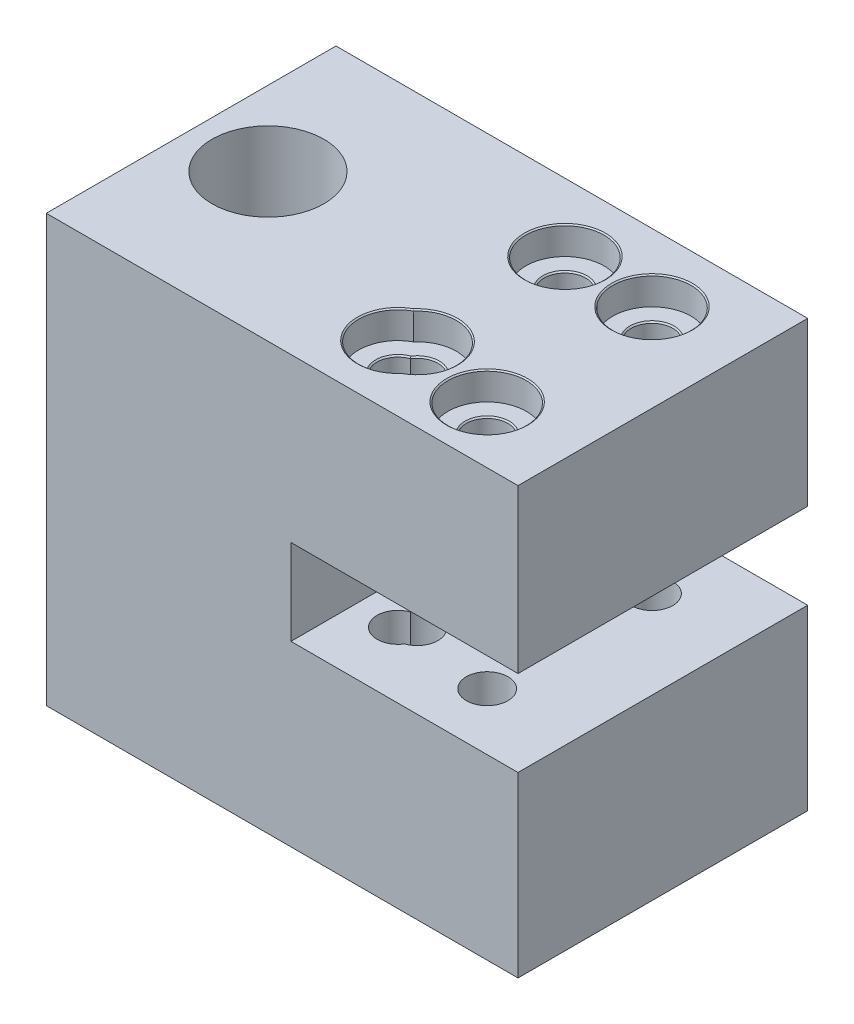
from build123d import *

# Parameters (mm, degrees)
SKETCH1_W                                      = 224.783024271
SKETCH1_H                                      = 138.046096427
BOSS_EXTRUDE1_DEPTH                            = 101.6
SKETCH2_R                                      = 26.66819347
CUT_EXTRUDE1_DEPTH                             = 108.204
SKETCH4_W                                      = 138.046096427
SKETCH4_H                                      = 40.817377809
CUT_EXTRUDE2_DEPTH                             = 108.204
CBORE_FOR_3_4_PAN_HEAD_MACHINE_SCREW1_AT_COUNT = 2
CBORE_FOR_3_4_PAN_HEAD_MACHINE_SCREW1_AT_PITCH = 78.529858642
CBORE_FOR_3_4_PAN_HEAD_MACHINE_SCREW_2_COUNT   = 2
CBORE_FOR_3_4_PAN_HEAD_MACHINE_SCREW_2_PITCH   = 88.813103961
CBORE_FOR_3_4_PAN_HEAD_MACHINE_SCREW_3_COUNT   = 2
CBORE_FOR_3_4_PAN_HEAD_MACHINE_SCREW_3_PITCH   = 46.772278414
CBORE_FOR_3_4_PAN_HEAD_MACHINE_SCREW_4_COUNT   = 2
CBORE_FOR_3_4_PAN_HEAD_MACHINE_SCREW_4_PITCH   = 42.272131605


with BuildPart() as part:
    # Sketch1 → Boss-Extrude1 (new, symmetric)
    with BuildSketch(Plane(origin=(0, 0, 0), x_dir=(1, 0, 0), z_dir=(0, 1, 0))):
        with Locations((-12.21646871, -1.018039059)):
            Rectangle(SKETCH1_W, SKETCH1_H)
    extrude(amount=BOSS_EXTRUDE1_DEPTH, both=True)

    # Sketch2 → Cut-Extrude1 (cut)
    with BuildSketch(Plane(origin=(0, 101.6, 0), x_dir=(1, 0, 0), z_dir=(0, 1, 0))):
        with Locations(Location((-89.023589675, 0, 0), (0, 0, 270))):
            Circle(SKETCH2_R)
    extrude(amount=-CUT_EXTRUDE1_DEPTH, mode=Mode.SUBTRACT)

    # Sketch4 → Cut-Extrude2 (cut)
    with BuildSketch(Plane(origin=(100.175043425, 0, 0), x_dir=(0, 0, -1), z_dir=(1, 0, 0))):
        with Locations((-1.018039059, 3.62821136)):
            Rectangle(SKETCH4_W, SKETCH4_H)
    extrude(amount=-CUT_EXTRUDE2_DEPTH, mode=Mode.SUBTRACT)

    # Sketch7 → CBORE for 3/4 Pan Head Machine Screw1 (revolve, cut)
    with BuildSketch(Plane(origin=(58.259270804, 101.6, 42.822055049), x_dir=(0, 0, 1), z_dir=(1, 0, 0))):
        Polygon((0, 0), (0, 203.2), (9.92124, 203.2), (9.92124, 13.8684), (10.55624, 13.2334), (18.65376, 13.2334), (18.65376, 0.532828266), (19.28876, 0), align=None)
    cbore_for_3_4_pan_head_machine_screw1 = revolve(axis=Axis((58.259270804, 107.95, 42.822055049), (0, -1, 0)), mode=Mode.SUBTRACT)

    # CBORE for 3/4 Pan Head Machine Screw1 at: CBORE for 3/4 Pan Head Machine Screw1 ×2
    with Locations(*[(0, 0, -i * CBORE_FOR_3_4_PAN_HEAD_MACHINE_SCREW1_AT_PITCH) for i in range(1, CBORE_FOR_3_4_PAN_HEAD_MACHINE_SCREW1_AT_COUNT)]):
        add(cbore_for_3_4_pan_head_machine_screw1, mode=Mode.SUBTRACT)

    # CBORE for 3_4 Pan Head Machine Screw 2: CBORE for 3/4 Pan Head Machine Screw1 ×2
    with Locations(*[Vector(-0.46708054288373707, 0, -0.8842147739432052) * (i * CBORE_FOR_3_4_PAN_HEAD_MACHINE_SCREW_2_PITCH) for i in range(1, CBORE_FOR_3_4_PAN_HEAD_MACHINE_SCREW_2_COUNT)]):
        add(cbore_for_3_4_pan_head_machine_screw1, mode=Mode.SUBTRACT)

    # CBORE for 3_4 Pan Head Machine Screw 3: CBORE for 3/4 Pan Head Machine Screw1 ×2
    with Locations(*[Vector(-0.9962520130083015, 0, -0.08649813048215103) * (i * CBORE_FOR_3_4_PAN_HEAD_MACHINE_SCREW_3_PITCH) for i in range(1, CBORE_FOR_3_4_PAN_HEAD_MACHINE_SCREW_3_COUNT)]):
        add(cbore_for_3_4_pan_head_machine_screw1, mode=Mode.SUBTRACT)

    # CBORE for 3_4 Pan Head Machine Screw 4: CBORE for 3/4 Pan Head Machine Screw1 ×2
    with Locations(*[Vector(-0.9813290988359743, 0, -0.19233616346848256) * (i * CBORE_FOR_3_4_PAN_HEAD_MACHINE_SCREW_4_PITCH) for i in range(1, CBORE_FOR_3_4_PAN_HEAD_MACHINE_SCREW_4_COUNT)]):
        add(cbore_for_3_4_pan_head_machine_screw1, mode=Mode.SUBTRACT)


solid = part.part
